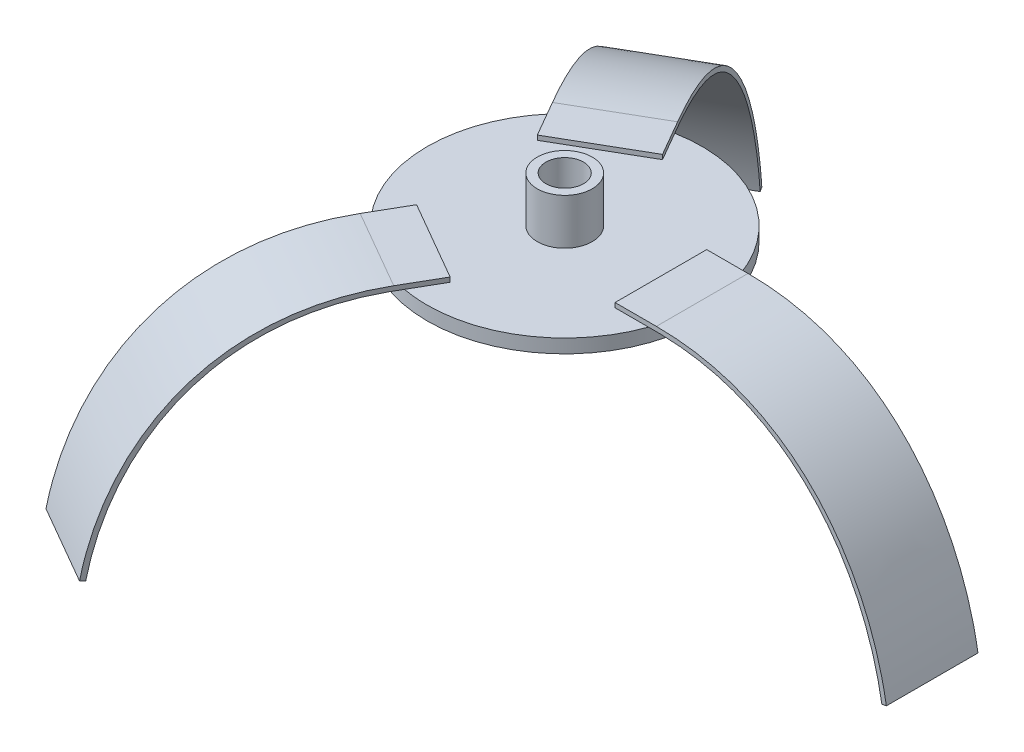
from build123d import *

# Parameters (mm, degrees)
SKETCH1_R           = 30
BOSS_EXTRUDE1_DEPTH = 3
SKETCH1_3_R         = 6
SKETCH1_3_R_2       = 4.1
BOSS_EXTRUDE2_DEPTH = 10
BOSS_EXTRUDE3_DEPTH = 10
CIRPATTERN4_COUNT   = 3


with BuildPart() as part:
    # Sketch1 → Boss-Extrude1 (new body)
    with BuildSketch(Plane(origin=(0, 0, 0), x_dir=(1, 0, 0), z_dir=(0, 1, 0))):
        Circle(SKETCH1_R)
    extrude(amount=-BOSS_EXTRUDE1_DEPTH)

    # Sketch1<3> → Boss-Extrude2 (add)
    with BuildSketch(Plane(origin=(0, 0, 0), x_dir=(1, 0, 0), z_dir=(0, 1, 0))):
        Circle(SKETCH1_3_R)
        Circle(SKETCH1_3_R_2, mode=Mode.SUBTRACT)
    extrude(amount=BOSS_EXTRUDE2_DEPTH)

    # Sketch3 → Boss-Extrude3 (add, symmetric)
    with BuildSketch(Plane.XY):
        with BuildLine():
            Line((20.986182934, 0), (20.986182934, 1))
            Line((20.986182934, 1), (30, 1))
            add(Edge.make_bspline(
                [(30, 1), (60.374034606, 1), (76.330152451, -22.351113915), (80.195520174, -45.635895635)],
                knots=[0, 0, 0, 0, 1, 1, 1, 1], degree=3))
            Line((80.195520174, -45.635895635), (79.209020453, -45.799658569))
            add(Edge.make_bspline(
                [(30.99996266, -0.008641626), (31.899242715, -0.024239786), (33.715729703, -0.099542856), (37.190019089, -0.416822027), (41.343618956, -1.117068291), (45.997769292, -2.40892623), (51.783186603, -4.689972725), (58.237135031, -8.508276888), (64.779288573, -14.388068011), (70.145770006, -21.31599418), (74.357167494, -29.037194285), (76.919217392, -35.910251352), (78.412064798, -41.54676245), (78.972472907, -44.374707991), (79.209020453, -45.799658569)],
                knots=[0.011223961, 0.011223961, 0.011223961, 0.011223961, 0.042123212, 0.073022463, 0.134820966, 0.196619468, 0.258417971, 0.382014975, 0.50561198, 0.629208985, 0.75280599, 0.876402995, 0.938201498, 1, 1, 1, 1], degree=3))
            Line((30.99996266, -0.008641626), (20.986182934, 0))
        make_face()
    boss_extrude3 = extrude(amount=BOSS_EXTRUDE3_DEPTH, both=True)

    # CirPattern4: Boss-Extrude3 ×3 about axis
    cirpattern4_axis = Axis((0, 10, 0), (0, -1, 0))
    for i in range(1, CIRPATTERN4_COUNT):
        add(boss_extrude3.rotate(cirpattern4_axis, i * 360 / CIRPATTERN4_COUNT))


solid = part.part
